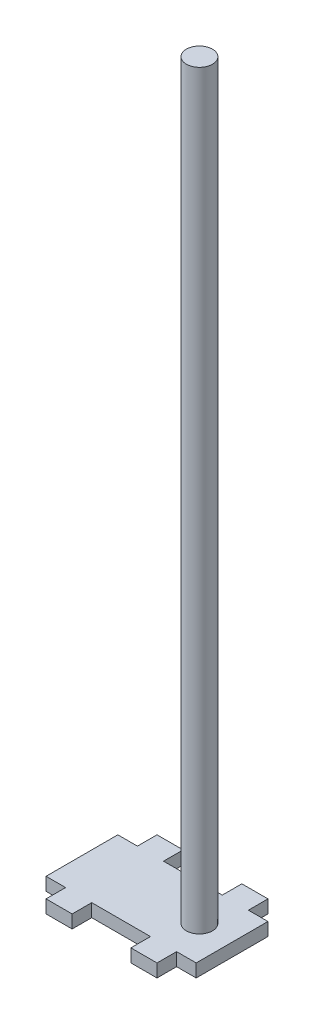
from build123d import *

# Parameters (mm, degrees)
SKETCH1_W           = 23
SKETCH1_H           = 11
BOSS_EXTRUDE1_DEPTH = 1
SKETCH3_W           = 4
SKETCH3_H           = 3
BOSS_EXTRUDE3_DEPTH = 1
SKETCH2_R           = 2
BOSS_EXTRUDE2_DEPTH = 115


with BuildPart() as part:
    # Sketch1 → Boss-Extrude1 (new, symmetric)
    with BuildSketch(Plane(origin=(0, 0, 0), x_dir=(1, 0, 0), z_dir=(0, 1, 0))):
        Rectangle(SKETCH1_W, SKETCH1_H)
    extrude(amount=BOSS_EXTRUDE1_DEPTH, both=True)

    # Sketch3 → Boss-Extrude3 (add, symmetric)
    with BuildSketch(Plane(origin=(0, 0, 0), x_dir=(1, 0, 0), z_dir=(0, 1, 0))):
        with Locations((6.5, 7)):
            Rectangle(SKETCH3_W, SKETCH3_H)
        with Locations((6.5, -7)):
            Rectangle(SKETCH3_W, SKETCH3_H)
        with Locations((-6.5, -7)):
            Rectangle(SKETCH3_W, SKETCH3_H)
        with Locations((-6.5, 7)):
            Rectangle(SKETCH3_W, SKETCH3_H)
    extrude(amount=BOSS_EXTRUDE3_DEPTH, both=True)

    # Sketch2 → Boss-Extrude2 (add)
    with BuildSketch(Plane(origin=(0, 1, 0), x_dir=(1, 0, 0), z_dir=(0, 1, 0))):
        with Locations(Location((6.5, 0, 0), (0, 0, 270))):
            Circle(SKETCH2_R)
    extrude(amount=BOSS_EXTRUDE2_DEPTH)


solid = part.part
